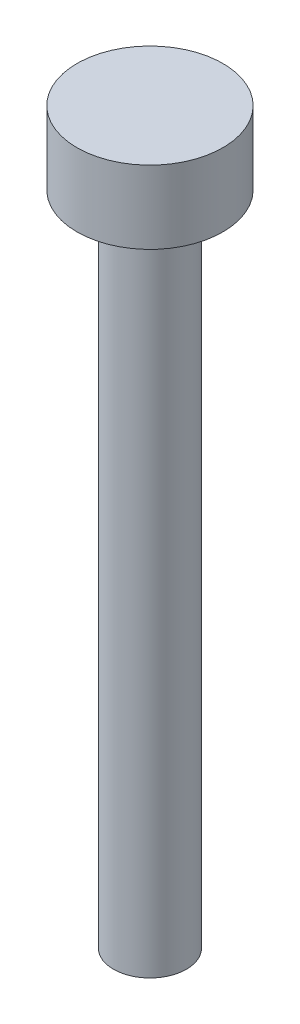
from build123d import *

# Parameters (mm, degrees)
SKETCH2_R           = 5
BOSS_EXTRUDE1_DEPTH = 5
SKETCH3_R           = 2.5
BOSS_EXTRUDE2_DEPTH = 45


with BuildPart() as part:
    # Sketch2 → Boss-Extrude1 (new body)
    with BuildSketch(Plane(origin=(0, 0, 0), x_dir=(1, 0, 0), z_dir=(0, 1, 0))):
        with Locations(Location((0, 0, 0), (0, 0, 270))):
            Circle(SKETCH2_R)
    extrude(amount=BOSS_EXTRUDE1_DEPTH)

    # Sketch3 → Boss-Extrude2 (add)
    with BuildSketch(Plane.XZ):
        with Locations(Location((0, 0, 0), (0, 0, 90))):
            Circle(SKETCH3_R)
    extrude(amount=BOSS_EXTRUDE2_DEPTH)


solid = part.part
